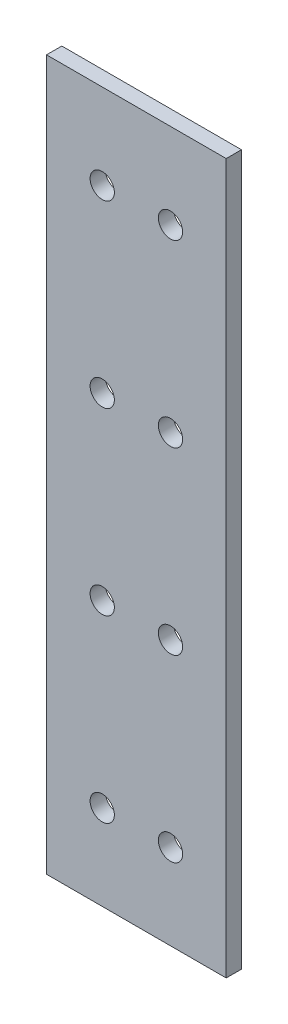
from build123d import *

# Parameters (mm, degrees)
SKETCH1_W           = 20
SKETCH1_H           = 79
BOSS_EXTRUDE1_DEPTH = 1.7
SKETCH3_R           = 1.35
CUT_EXTRUDE1_DEPTH  = 41.781613504


with BuildPart() as part:
    # Sketch1 → Boss-Extrude1 (new body)
    with BuildSketch(Plane.XY):
        Rectangle(SKETCH1_W, SKETCH1_H)
    extrude(amount=BOSS_EXTRUDE1_DEPTH)

    # Sketch3 → Cut-Extrude1 (cut, through all)
    with BuildSketch(Plane.XY.offset(1.7)):
        with Locations((-3.8, 30)):
            Circle(SKETCH3_R)
        with Locations((-3.8, 10)):
            Circle(SKETCH3_R)
        with Locations((-3.8, -10)):
            Circle(SKETCH3_R)
        with Locations((-3.8, -30)):
            Circle(SKETCH3_R)
        with Locations(Location((3.8, -30, 0), (0, 0, 180))):
            Circle(SKETCH3_R)
        with Locations(Location((3.8, -10, 0), (0, 0, 180))):
            Circle(SKETCH3_R)
        with Locations(Location((3.8, 10, 0), (0, 0, 180))):
            Circle(SKETCH3_R)
        with Locations(Location((3.8, 30, 0), (0, 0, 180))):
            Circle(SKETCH3_R)
    extrude(amount=-CUT_EXTRUDE1_DEPTH, mode=Mode.SUBTRACT)


solid = part.part
